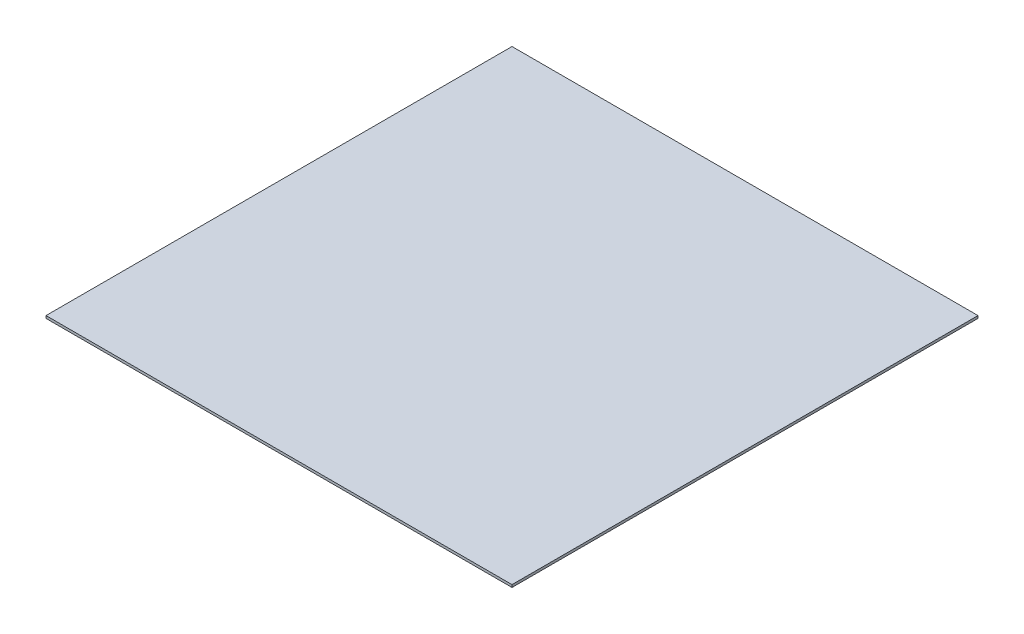
from build123d import *

# Parameters (mm, degrees)
SKETCH1_W           = 560
SKETCH1_H           = 560
BOSS_EXTRUDE1_DEPTH = 3


with BuildPart() as part:
    # Sketch1 → Boss-Extrude1 (new body)
    with BuildSketch(Plane(origin=(0, 0, 0), x_dir=(1, 0, 0), z_dir=(0, 1, 0))):
        with Locations((280, 280)):
            Rectangle(SKETCH1_W, SKETCH1_H)
    extrude(amount=BOSS_EXTRUDE1_DEPTH)


solid = part.part
